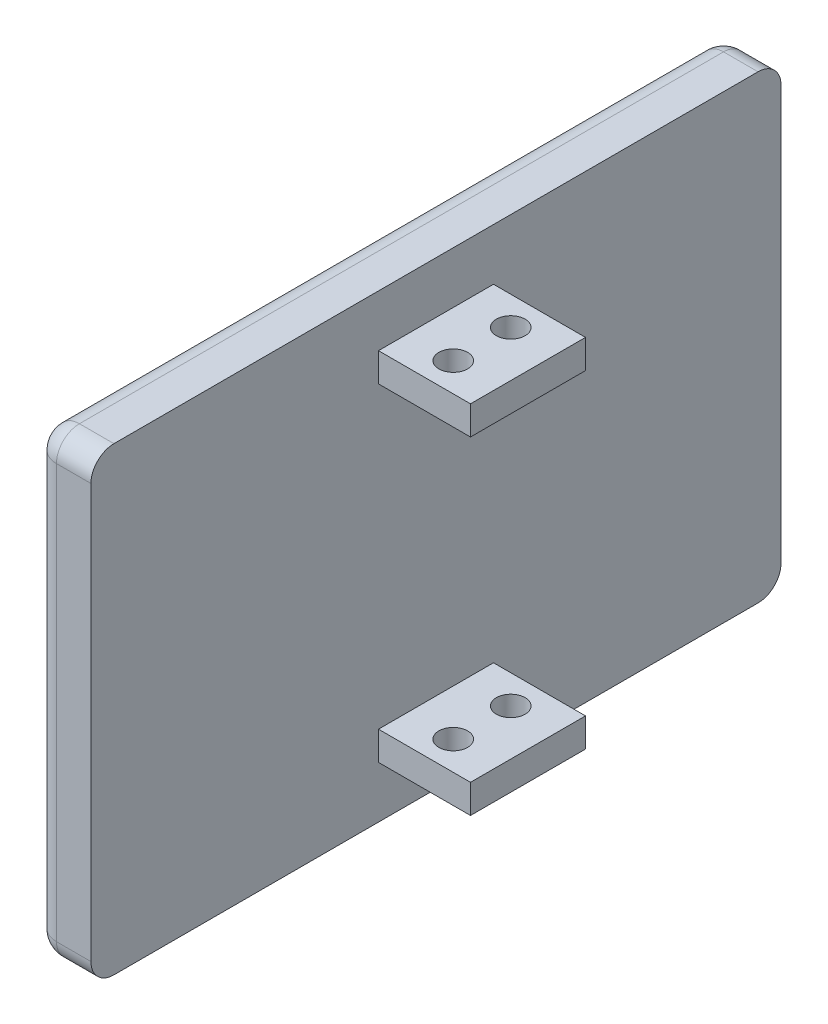
from build123d import *

# Parameters (mm, degrees)
SKETCH1_W           = 76.2
SKETCH1_H           = 50.8
BOSS_EXTRUDE1_DEPTH = 6.35
SKETCH2_W           = 12.7
SKETCH2_H           = 3.175
BOSS_EXTRUDE2_DEPTH = 10.16
FILLET1_R           = 2.54
CUT_EXTRUDE1_REACH  = 63.293
SKETCH3_R           = 1.5875


with BuildPart() as part:
    # Sketch1 → Boss-Extrude1 (new body)
    with BuildSketch(Plane(origin=(0, 0, 0), x_dir=(0, 0, -1), z_dir=(1, 0, 0))):
        Rectangle(SKETCH1_W, SKETCH1_H)
    extrude(amount=BOSS_EXTRUDE1_DEPTH)

    # Sketch2 → Boss-Extrude2 (add)
    with BuildSketch(Plane(origin=(6.35, 0, 0), x_dir=(0, 0, -1), z_dir=(1, 0, 0))):
        with Locations((0, -18.0975)):
            Rectangle(SKETCH2_W, SKETCH2_H)
        with Locations((0, 18.0975)):
            Rectangle(SKETCH2_W, SKETCH2_H)
    extrude(amount=BOSS_EXTRUDE2_DEPTH)

    # Fillet1
    fillet1_edges = [part.edges().sort_by_distance(p)[0] for p in [
        (0, 25.4, 0),
        (0, 0, -38.1),
        (0, -25.4, 0),
        (0, 0, 38.1),
        (3.175, 25.4, 38.1),
        (3.175, 25.4, -38.1),
        (3.175, -25.4, -38.1),
        (3.175, -25.4, 38.1),
    ]]
    fillet(fillet1_edges, radius=FILLET1_R)

    # Cut-Extrude1: up to this face of the body (flat: up to its plane)
    cut_extrude1_end = Plane(part.part.faces().sort_by_distance((11.43, -19.685, 0))[0])
    # Sketch3 → Cut-Extrude1 (cut, up to the picked face)
    with BuildSketch(Plane(origin=(0, 19.685, 0), x_dir=(1, 0, 0), z_dir=(0, 1, 0)), mode=Mode.PRIVATE) as cut_extrude1_sk1:
        with Locations(Location((11.43, -3.175, 0), (0, 0, 270))):
            Circle(SKETCH3_R)
    cut_extrude1_tool1 = split(extrude(cut_extrude1_sk1.sketch, amount=-CUT_EXTRUDE1_REACH, mode=Mode.PRIVATE), bisect_by=cut_extrude1_end, keep=Keep.BOTH, mode=Mode.PRIVATE)
    # Sketch3 → Cut-Extrude1 (cut, up to the picked face)
    with BuildSketch(Plane(origin=(0, 19.685, 0), x_dir=(1, 0, 0), z_dir=(0, 1, 0)), mode=Mode.PRIVATE) as cut_extrude1_sk2:
        with Locations(Location((11.43, 3.175, 0), (0, 0, 270))):
            Circle(SKETCH3_R)
    cut_extrude1_tool2 = split(extrude(cut_extrude1_sk2.sketch, amount=-CUT_EXTRUDE1_REACH, mode=Mode.PRIVATE), bisect_by=cut_extrude1_end, keep=Keep.BOTH, mode=Mode.PRIVATE)
    add(cut_extrude1_tool1.solids().sort_by(Axis((11.43, 19.685, 3.175), (0, -1, 0)))[0], mode=Mode.SUBTRACT)
    add(cut_extrude1_tool2.solids().sort_by(Axis((11.43, 19.685, -3.175), (0, -1, 0)))[0], mode=Mode.SUBTRACT)


solid = part.part
